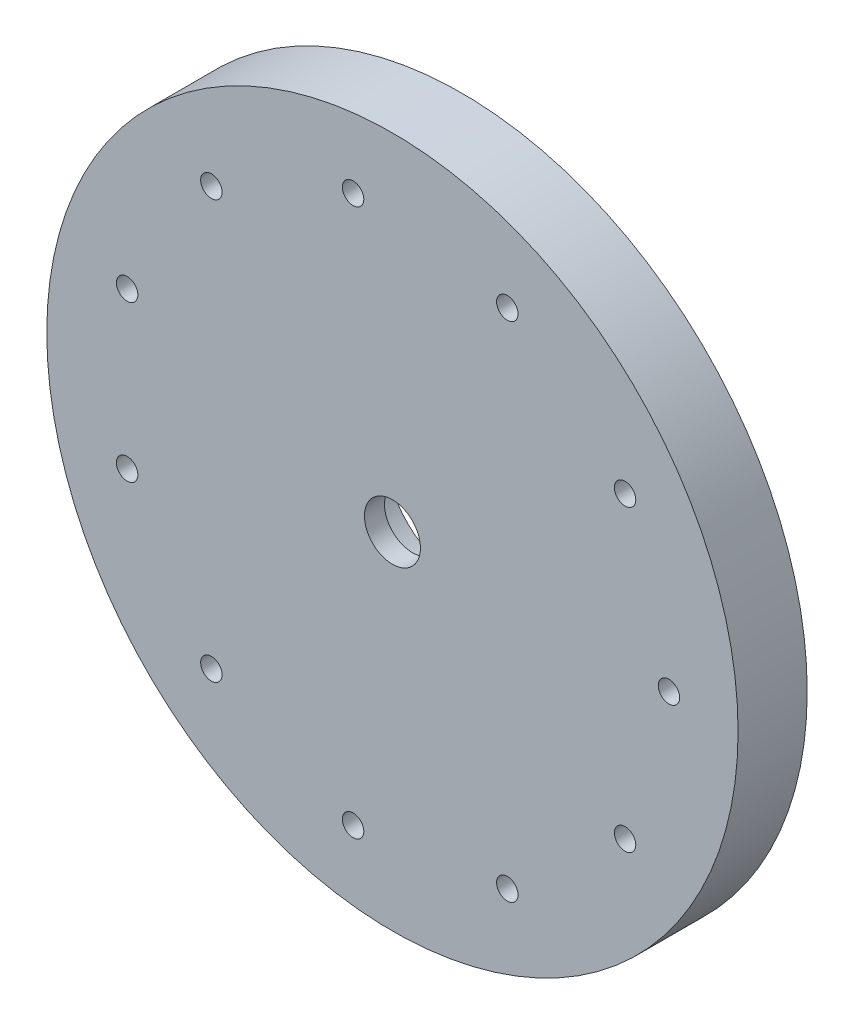
from build123d import *

# Parameters (mm, degrees)
SKETCH1_R           = 50
SKETCH1_R_2         = 11.05
SKETCH1_R_3         = 1.55
BOSS_EXTRUDE1_DEPTH = 10
BOSS_EXTRUDE2_START = -2.9
SKETCH2_R           = 11.05
SKETCH2_R_2         = 4.05
BOSS_EXTRUDE2_DEPTH = 2.9


with BuildPart() as part:
    # Sketch1 → Boss-Extrude1 (new body)
    with BuildSketch(Plane.XY):
        Circle(SKETCH1_R)
        Circle(SKETCH1_R_2, mode=Mode.SUBTRACT)
        with Locations((40, 0)):
            Circle(SKETCH1_R_3, mode=Mode.SUBTRACT)
        with Locations((33.650141313, -21.625632698)):
            Circle(SKETCH1_R_3, mode=Mode.SUBTRACT)
        with Locations((16.61660052, -36.385279814)):
            Circle(SKETCH1_R_3, mode=Mode.SUBTRACT)
        with Locations((-5.692593531, -39.592857675)):
            Circle(SKETCH1_R_3, mode=Mode.SUBTRACT)
        with Locations((-26.194429358, -30.229982974)):
            Circle(SKETCH1_R_3, mode=Mode.SUBTRACT)
        with Locations((-38.379718945, -11.269302274)):
            Circle(SKETCH1_R_3, mode=Mode.SUBTRACT)
        with Locations((-38.379718945, 11.269302274)):
            Circle(SKETCH1_R_3, mode=Mode.SUBTRACT)
        with Locations((-26.194429358, 30.229982974)):
            Circle(SKETCH1_R_3, mode=Mode.SUBTRACT)
        with Locations((-5.692593531, 39.592857675)):
            Circle(SKETCH1_R_3, mode=Mode.SUBTRACT)
        with Locations((16.61660052, 36.385279814)):
            Circle(SKETCH1_R_3, mode=Mode.SUBTRACT)
        with Locations((33.650141313, 21.625632698)):
            Circle(SKETCH1_R_3, mode=Mode.SUBTRACT)
    extrude(amount=BOSS_EXTRUDE1_DEPTH)

    # Sketch2 → Boss-Extrude2 (add)
    with BuildSketch(Plane.XY.offset(10).offset(BOSS_EXTRUDE2_START)):
        Circle(SKETCH2_R)
        Circle(SKETCH2_R_2, mode=Mode.SUBTRACT)
    extrude(amount=BOSS_EXTRUDE2_DEPTH)


solid = part.part
